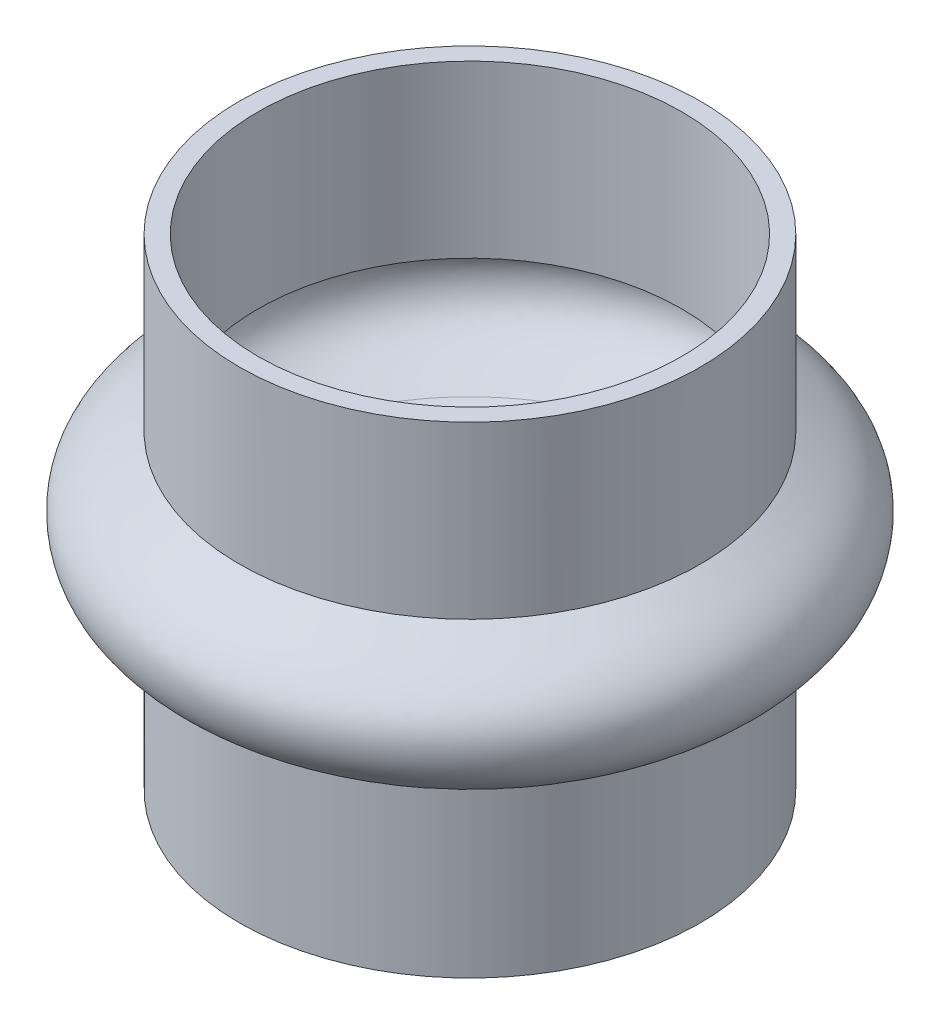
from build123d import *

# Parameters (mm, degrees)
SKETCH2_R           = 13.5
SKETCH2_R_2         = 12.414321286
BOSS_EXTRUDE1_DEPTH = 10


with BuildPart() as part:
    # Sketch1 → Revolve1 (revolve)
    with BuildSketch(Plane.XY):
        with BuildLine():
            Line((7.325278854, 63.411883954), (8.410957568, 63.411883954))
            Line((8.410957568, 63.411883954), (7.555549556, 62.968064842))
            add(Edge.make_bspline(
                [(7.555549556, 62.968064842), (7.34999991, 62.861417651), (6.947144673, 62.660387479), (6.05410487, 62.201842629), (4.95450234, 61.540590874), (4.15954484, 60.725704583), (3.843595581, 60.013758398), (3.734630504, 59.178179351), (3.989989442, 58.064696871), (4.831837818, 57.106551686), (6.08596344, 56.311379341), (6.949277865, 55.883126275), (7.373486281, 55.648841265)],
                knots=[0, 0, 0, 0, 0.0625, 0.125, 0.25, 0.375, 0.4375, 0.5, 0.625, 0.75, 0.875, 1, 1, 1, 1], degree=3))
            Line((7.373486281, 55.648841265), (8.165980219, 55.21115676))
            Line((8.165980219, 55.21115676), (7.131758595, 55.21115676))
            add(Edge.make_bspline(
                [(7.325278854, 63.411883954), (6.011135244, 62.730054884), (2.971783405, 61.4251647), (3.46335157, 56.912604996), (5.942640085, 55.867892063), (7.131758595, 55.21115676)],
                knots=[0, 0, 0, 0, 0.430000258, 0.624673055, 1, 1, 1, 1], degree=3))
        make_face()
    revolve(axis=Axis((20.825278854, 76.539342874, 0), (0, -1, 0)))

    # Sketch2 → Boss-Extrude1 (add)
    with BuildSketch(Plane(origin=(0, 63.411883954, 0), x_dir=(1, 0, 0), z_dir=(0, 1, 0))):
        with Locations(Location((20.825278854, 0, 0), (0, 0, 180))):
            Circle(SKETCH2_R)
        with Locations(Location((20.825278854, 0, 0), (0, 0, 270))):
            Circle(SKETCH2_R_2, mode=Mode.SUBTRACT)
    boss_extrude1 = extrude(amount=BOSS_EXTRUDE1_DEPTH)

    # Mirror1: Boss-Extrude1 across plane
    add(boss_extrude1.mirror(Plane.ZX.offset(59.311520357)))


solid = part.part
